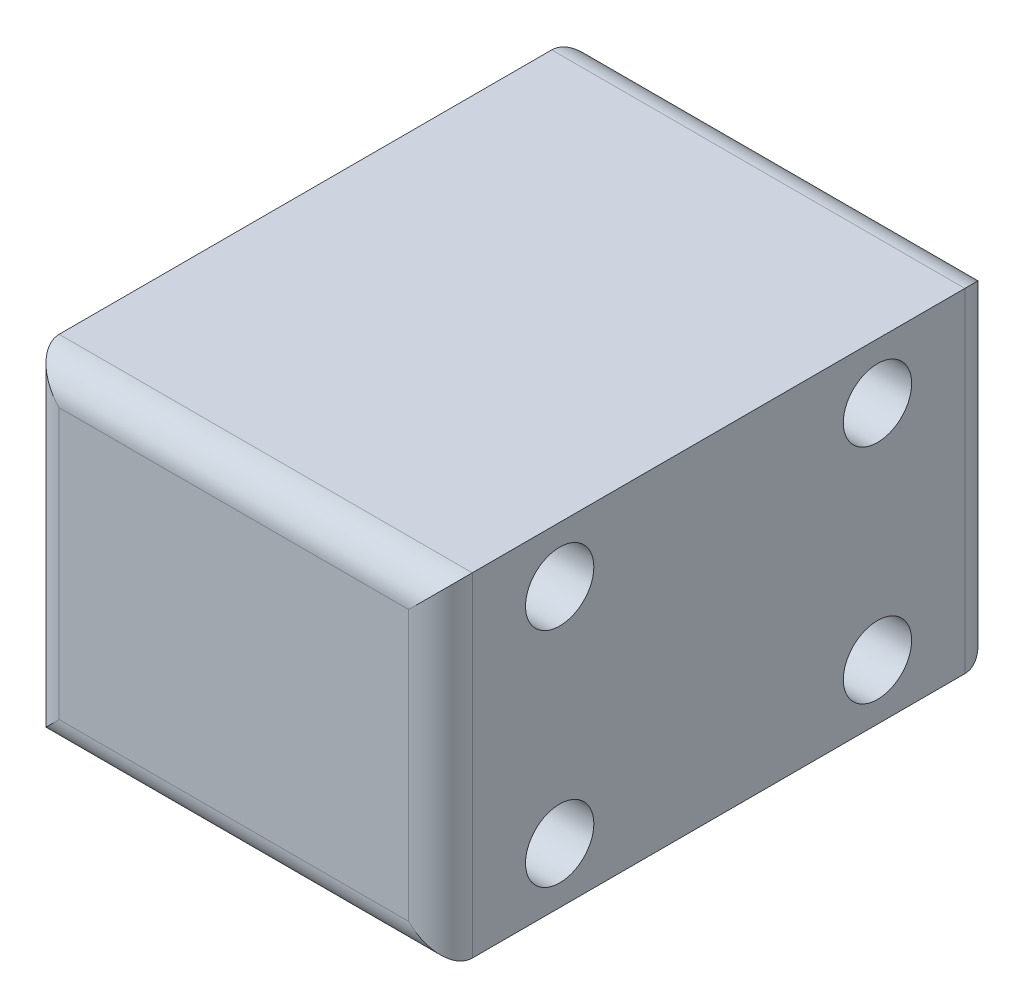
from build123d import *

# Parameters (mm, degrees)
SKETCH_1_W          = 26
SKETCH_1_H          = 21
EXTRUDE_1_DEPTH     = 35
CUT_EXTRUDE_1_REACH = 50.394
SKETCH_2_R          = 2.15
FILLET_1_R          = 2


with BuildPart() as part:
    # 草图1 → 凸台-拉伸1 (new body)
    with BuildSketch(Plane.XY):
        with Locations((-13, 10.5)):
            Rectangle(SKETCH_1_W, SKETCH_1_H)
    extrude(amount=EXTRUDE_1_DEPTH)

    # 草图2 → 切除-拉伸1 (cut, up to next)
    with BuildSketch(Plane(origin=(0, 0, 0), x_dir=(0, 0, -1), z_dir=(1, 0, 0)), mode=Mode.PRIVATE) as cut_extrude_1_sk1:
        with Locations((-27.5, 17.5)):
            Circle(SKETCH_2_R)
    cut_extrude_1_tool1 = extrude(cut_extrude_1_sk1.sketch, amount=-CUT_EXTRUDE_1_REACH, mode=Mode.PRIVATE) & part.part
    # 草图2 → 切除-拉伸1 (cut, up to next)
    with BuildSketch(Plane(origin=(0, 0, 0), x_dir=(0, 0, -1), z_dir=(1, 0, 0)), mode=Mode.PRIVATE) as cut_extrude_1_sk2:
        with Locations((-27.5, 3.5)):
            Circle(SKETCH_2_R)
    cut_extrude_1_tool2 = extrude(cut_extrude_1_sk2.sketch, amount=-CUT_EXTRUDE_1_REACH, mode=Mode.PRIVATE) & part.part
    # 草图2 → 切除-拉伸1 (cut, up to next)
    with BuildSketch(Plane(origin=(0, 0, 0), x_dir=(0, 0, -1), z_dir=(1, 0, 0)), mode=Mode.PRIVATE) as cut_extrude_1_sk3:
        with Locations((-7.5, 17.5)):
            Circle(SKETCH_2_R)
    cut_extrude_1_tool3 = extrude(cut_extrude_1_sk3.sketch, amount=-CUT_EXTRUDE_1_REACH, mode=Mode.PRIVATE) & part.part
    # 草图2 → 切除-拉伸1 (cut, up to next)
    with BuildSketch(Plane(origin=(0, 0, 0), x_dir=(0, 0, -1), z_dir=(1, 0, 0)), mode=Mode.PRIVATE) as cut_extrude_1_sk4:
        with Locations((-7.5, 3.5)):
            Circle(SKETCH_2_R)
    cut_extrude_1_tool4 = extrude(cut_extrude_1_sk4.sketch, amount=-CUT_EXTRUDE_1_REACH, mode=Mode.PRIVATE) & part.part
    add(cut_extrude_1_tool1.solids().sort_by_distance((0, 17.5, 27.5))[0], mode=Mode.SUBTRACT)
    add(cut_extrude_1_tool2.solids().sort_by_distance((0, 3.5, 27.5))[0], mode=Mode.SUBTRACT)
    add(cut_extrude_1_tool3.solids().sort_by_distance((0, 17.5, 7.5))[0], mode=Mode.SUBTRACT)
    add(cut_extrude_1_tool4.solids().sort_by_distance((0, 3.5, 7.5))[0], mode=Mode.SUBTRACT)

    # 圆角1
    fillet_1_edges = [part.edges().sort_by_distance(p)[0] for p in [
        (-26, 10.5, 35),
        (-13, 0, 35),
        (0, 10.5, 35),
        (-13, 0, 0),
        (-26, 10.5, 0),
        (-13, 21, 0),
        (0, 10.5, 0),
        (-13, 21, 35),
    ]]
    fillet(fillet_1_edges, radius=FILLET_1_R)


solid = part.part
